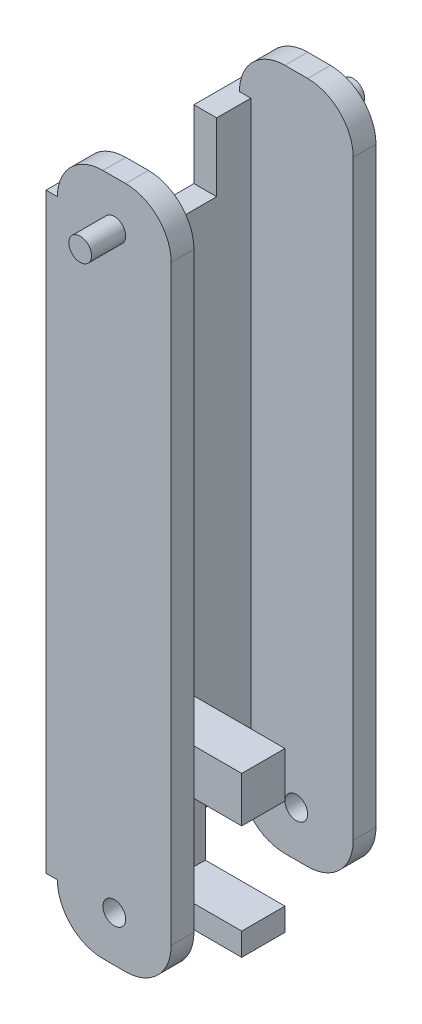
from build123d import *

# Parameters (mm, degrees)
SKETCH1_R           = 5
BOSS_EXTRUDE1_DEPTH = 10
SKETCH2_R           = 5
BOSS_EXTRUDE2_DEPTH = 15
SKETCH3_W           = 5
SKETCH3_H           = 260
BOSS_EXTRUDE3_DEPTH = 35
SKETCH8_W           = 5
SKETCH8_H           = 19
BOSS_EXTRUDE4_DEPTH = 20
SKETCH9_W           = 19
SKETCH9_H           = 10
SKETCH9_H_2         = 20
BOSS_EXTRUDE5_DEPTH = 45
SKETCH10_W          = 19
SKETCH10_H          = 40
BOSS_EXTRUDE6_DEPTH = 10
BOSS_EXTRUDE7_DEPTH = 5
SKETCH13_W          = 40
SKETCH13_H          = 30
CUT_EXTRUDE1_DEPTH  = 10


with BuildPart() as part:
    # Sketch1 → Boss-Extrude1 (new body)
    with BuildSketch(Plane.XY):
        with BuildLine():
            Line((-5, -20), (5, -20))
            ThreePointArc((5, -20), (19.142135624, -14.142135624), (25, 0))
            Line((25, 0), (25, 260))
            ThreePointArc((25, 260), (19.142135624, 274.142135624), (5, 280))
            Line((5, 280), (-5, 280))
            ThreePointArc((-5, 280), (-19.142135624, 274.142135624), (-25, 260))
            Line((-25, 260), (-25, 0))
            ThreePointArc((-25, 0), (-19.142135624, -14.142135624), (-5, -20))
        make_face()
        Circle(SKETCH1_R, mode=Mode.SUBTRACT)
    boss_extrude1 = extrude(amount=BOSS_EXTRUDE1_DEPTH)

    # Sketch2 → Boss-Extrude2 (add)
    with BuildSketch(Plane.XY.offset(10)):
        with Locations((0, 260)):
            Circle(SKETCH2_R)
    boss_extrude2 = extrude(amount=BOSS_EXTRUDE2_DEPTH)

    # Sketch3 → Boss-Extrude3 (add)
    with BuildSketch(Plane(origin=(0, 0, 0), x_dir=(-1, 0, 0), z_dir=(0, 0, -1))):
        with Locations((22.5, 130)):
            Rectangle(SKETCH3_W, SKETCH3_H)
    boss_extrude3 = extrude(amount=BOSS_EXTRUDE3_DEPTH)

    # Mirror1: Boss-Extrude1, Boss-Extrude2, Boss-Extrude3 across plane
    add(boss_extrude1.mirror(Plane.XY.offset(-35)))
    add(boss_extrude2.mirror(Plane.XY.offset(-35)))
    add(boss_extrude3.mirror(Plane.XY.offset(-35)))

    # Sketch8 → Boss-Extrude4 (add)
    with BuildSketch(Plane.XZ):
        with Locations((-22.5, -30.5)):
            Rectangle(SKETCH8_W, SKETCH8_H)
    extrude(amount=BOSS_EXTRUDE4_DEPTH)

    # Sketch9 → Boss-Extrude5 (add)
    with BuildSketch(Plane(origin=(-20, 0, 0), x_dir=(0, 0, -1), z_dir=(1, 0, 0))):
        with Locations((30.5, -15)):
            Rectangle(SKETCH9_W, SKETCH9_H)
        with Locations((30.5, 40)):
            Rectangle(SKETCH9_W, SKETCH9_H_2)
    extrude(amount=BOSS_EXTRUDE5_DEPTH)

    # Sketch10 → Boss-Extrude6 (add)
    with BuildSketch(Plane(origin=(-20, 0, 0), x_dir=(0, 0, -1), z_dir=(1, 0, 0))):
        with Locations((30.5, 10)):
            Rectangle(SKETCH10_W, SKETCH10_H)
    extrude(amount=BOSS_EXTRUDE6_DEPTH)

    # Sketch12 → Boss-Extrude7 (add)
    with BuildSketch(Plane.ZY.offset(25)):
        Polygon((-80, 260), (10, 260), (10, 0), (-21, 0), (-21, -20), (-40, -20), (-40, 0), (-80, 0), align=None)
    extrude(amount=BOSS_EXTRUDE7_DEPTH)

    # Sketch13 → Cut-Extrude1 (cut)
    with BuildSketch(Plane.ZY.offset(30)):
        with Locations((-35, 245)):
            Rectangle(SKETCH13_W, SKETCH13_H)
    extrude(amount=-CUT_EXTRUDE1_DEPTH, mode=Mode.SUBTRACT)


solid = part.part
